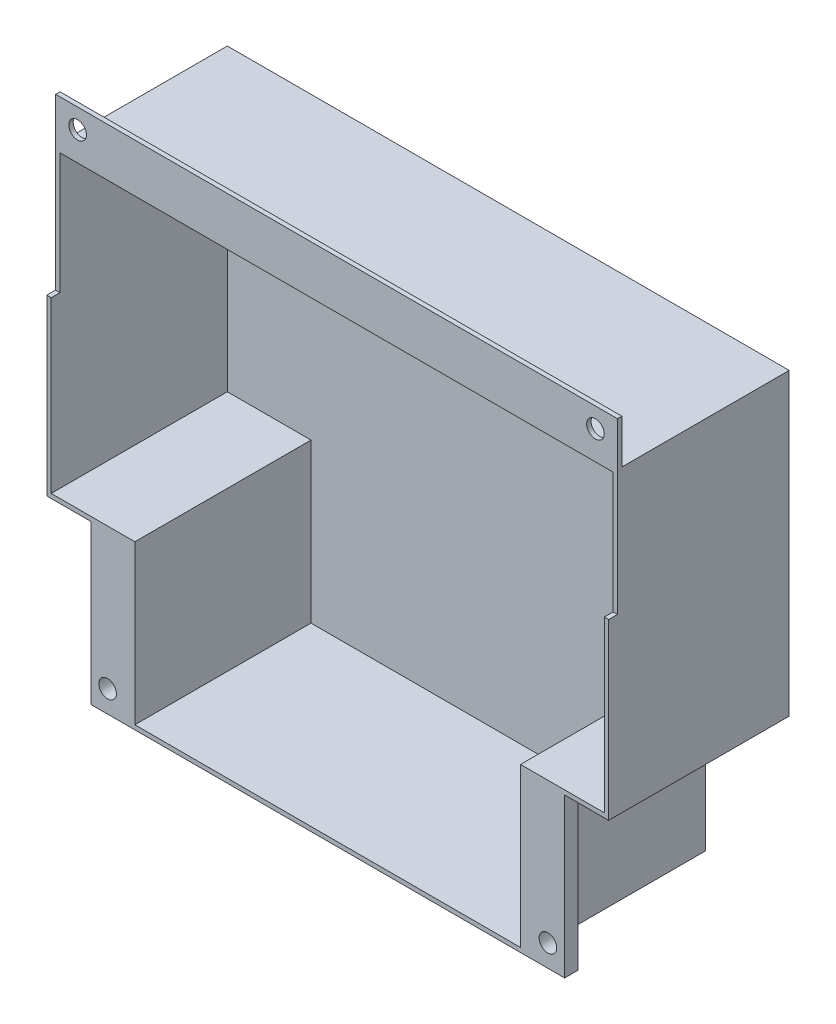
from build123d import *

# Parameters (mm, degrees)
EXTRUDE_1_DEPTH     = 1
EXTRUDE_2_DEPTH     = 40
SKETCH_3_W          = 127.6
SKETCH_3_H          = 10
SKETCH_3_R          = 2
SKETCH_3_W_2        = 10
SKETCH_3_H_2        = 37
EXTRUDE_3_DEPTH     = 3
SKETCH_4_W          = 2
SKETCH_4_H          = 38.5
CUT_EXTRUDE_1_DEPTH = 176.951015911


with BuildPart() as part:
    # 草图1 → 凸台-拉伸1 (new body)
    with BuildSketch(Plane.XY):
        Polygon((-63.8, 104), (63.8, 104), (63.8, 36), (44.8, 36), (44.8, 0), (-44.8, 0), (-44.8, 36), (-63.8, 36), align=None)
    extrude(amount=EXTRUDE_1_DEPTH)

    # 草图2 → 凸台-拉伸2 (add)
    with BuildSketch(Plane.XY.offset(1)):
        Polygon((-44.8, 36), (-44.8, 0), (44.8, 0), (44.8, 36), (63.8, 36), (63.8, 104), (-63.8, 104), (-63.8, 36), align=None)
        Polygon((62.8, 103), (-62.8, 103), (-62.8, 37), (-43.8, 37), (-43.8, 1), (43.8, 1), (43.8, 37), (62.8, 37), align=None, mode=Mode.SUBTRACT)
    extrude(amount=EXTRUDE_2_DEPTH)

    # 草图3 → 凸台-拉伸3 (add)
    # profile 1 of 3: a face of its own
    with BuildSketch(Plane.XY.offset(41)):
        with Locations((0, 109)):
            Rectangle(SKETCH_3_W, SKETCH_3_H)
        with Locations((58.8, 109.5)):
            Circle(SKETCH_3_R, mode=Mode.SUBTRACT)
        with Locations(Location((-58.8, 109.5, 0), (0, 0, 180))):
            Circle(SKETCH_3_R, mode=Mode.SUBTRACT)
    # profile 2 of 3: a face of its own
    with BuildSketch(Plane.XY.offset(41)):
        with Locations((48.8, 18.5)):
            Rectangle(SKETCH_3_W_2, SKETCH_3_H_2)
        with Locations((50, 5)):
            Circle(SKETCH_3_R, mode=Mode.SUBTRACT)
    # profile 3 of 3: a face of its own
    with BuildSketch(Plane.XY.offset(41)):
        with Locations((-48.8, 18.5)):
            Rectangle(SKETCH_3_W_2, SKETCH_3_H_2)
        with Locations(Location((-50, 5, 0), (0, 0, 180))):
            Circle(SKETCH_3_R, mode=Mode.SUBTRACT)
    extrude(amount=-EXTRUDE_3_DEPTH)

    # 草图4 → 切除-拉伸1 (cut, through all)
    with BuildSketch(Plane.ZY.offset(63.8)):
        with Locations((40, 94.75)):
            Rectangle(SKETCH_4_W, SKETCH_4_H)
    extrude(amount=-CUT_EXTRUDE_1_DEPTH, mode=Mode.SUBTRACT)


solid = part.part
